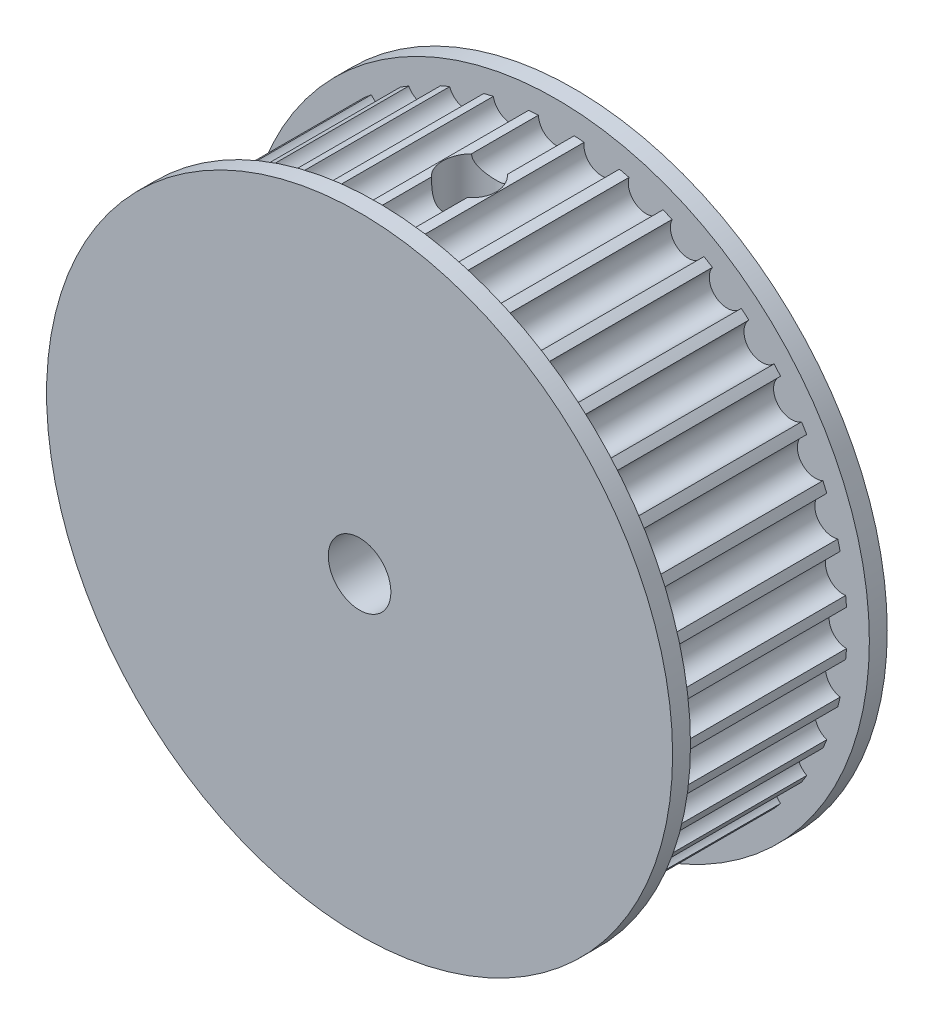
from build123d import *

# Parameters (mm, degrees)
SKETCH1_R           = 35
SKETCH1_R_2         = 3.5
BOSS_EXTRUDE1_DEPTH = 24
SKETCH3_OUTSIDE_W   = 92.372
SKETCH3_OUTSIDE_H   = 92.372
SKETCH3_OUTSIDE_R   = 32.5
CUT_EXTRUDE1_DEPTH  = 20
CUT_EXTRUDE2_DEPTH  = 20
SKETCH5_R           = 3
CUT_EXTRUDE3_DEPTH  = 56.009090158


with BuildPart() as part:
    # Sketch1 → Boss-Extrude1 (new body)
    with BuildSketch(Plane.XY):
        Circle(SKETCH1_R)
        Circle(SKETCH1_R_2, mode=Mode.SUBTRACT)
    extrude(amount=-BOSS_EXTRUDE1_DEPTH)

    # Sketch3 outside → Cut-Extrude1 (cut)
    with BuildSketch(Plane.XY.offset(-2)):
        Rectangle(SKETCH3_OUTSIDE_W, SKETCH3_OUTSIDE_H)
        Circle(SKETCH3_OUTSIDE_R, mode=Mode.SUBTRACT)
    extrude(amount=-CUT_EXTRUDE1_DEPTH, mode=Mode.SUBTRACT)

    # Sketch4 → Cut-Extrude2 (cut)
    with BuildSketch(Plane.XY.offset(-2)):
        with BuildLine():
            ThreePointArc((-20.684282661, 25.06811622), (-17.923091739, 24.669019428), (-17.449400423, 27.418395738))
            ThreePointArc((-17.449400423, 27.418395738), (-19.1030207, 26.293052317), (-20.684282661, 25.06811622))
        make_face()
        with BuildLine():
            ThreePointArc((-16.508107467, 27.995220804), (-13.84334388, 27.169092131), (-12.945387279, 29.810517409))
            ThreePointArc((-12.945387279, 29.810517409), (-14.754691242, 28.957712036), (-16.508107467, 27.995220804))
        make_face()
        with BuildLine():
            ThreePointArc((-11.925447881, 30.232990141), (-9.422726952, 29.000171617), (-8.122615736, 31.468605206))
            ThreePointArc((-8.122615736, 31.468605206), (-10.043052317, 30.90933678), (-11.925447881, 30.232990141))
        make_face()
        with BuildLine():
            ThreePointArc((-7.049144189, 31.726322923), (-4.770091215, 30.117170631), (-3.099838437, 32.351831504))
            ThreePointArc((-3.099838437, 32.351831504), (-5.084120114, 32.099871069), (-7.049144189, 31.726322923))
        make_face()
        with BuildLine():
            ThreePointArc((-1.999267173, 32.438448341), (-1.394942074, 31.059359006), (0, 30.492584951))
            Line((0, 30.492584951), (0, 32.5))
            ThreePointArc((0, 32.5), (-1.000107224, 32.484608441), (-1.999267173, 32.438448341))
        make_face()
        with BuildLine():
            Line((0, 32.5), (0, 30.492584951))
            ThreePointArc((0, 30.492584951), (1.394942074, 31.059359006), (1.999267173, 32.438448341))
            ThreePointArc((1.999267173, 32.438448341), (1.000107224, 32.484608441), (0, 32.5))
        make_face()
        with BuildLine():
            ThreePointArc((7.049144189, 31.726322923), (5.084120114, 32.099871069), (3.099838437, 32.351831504))
            ThreePointArc((3.099838437, 32.351831504), (4.770091215, 30.117170631), (7.049144189, 31.726322923))
        make_face()
        with BuildLine():
            ThreePointArc((11.925447881, 30.232990141), (10.043052317, 30.90933678), (8.122615736, 31.468605206))
            ThreePointArc((8.122615736, 31.468605206), (9.422726952, 29.000171617), (11.925447881, 30.232990141))
        make_face()
        with BuildLine():
            ThreePointArc((16.508107467, 27.995220804), (14.754691242, 28.957712036), (12.945387279, 29.810517409))
            ThreePointArc((12.945387279, 29.810517409), (13.84334388, 27.169092131), (16.508107467, 27.995220804))
        make_face()
        with BuildLine():
            ThreePointArc((20.684282661, 25.06811622), (19.1030207, 26.293052317), (17.449400423, 27.418395738))
            ThreePointArc((17.449400423, 27.418395738), (17.923091739, 24.669019428), (20.684282661, 25.06811622))
        make_face()
        with BuildLine():
            ThreePointArc((24.351142168, 21.523751418), (22.980970389, 22.980970389), (21.523751418, 24.351142168))
            ThreePointArc((21.523751418, 24.351142168), (21.561513595, 21.561513595), (24.351142168, 21.523751418))
        make_face()
        with BuildLine():
            ThreePointArc((27.418395738, 17.449400423), (26.293052317, 19.1030207), (25.06811622, 20.684282661))
            ThreePointArc((25.06811622, 20.684282661), (24.669019428, 17.923091739), (27.418395738, 17.449400423))
        make_face()
        with BuildLine():
            ThreePointArc((29.810517409, 12.945387279), (28.957712036, 14.754691242), (27.995220804, 16.508107467))
            ThreePointArc((27.995220804, 16.508107468), (27.169092131, 13.84334388), (29.810517409, 12.945387279))
        make_face()
        with BuildLine():
            ThreePointArc((31.468605206, 8.122615736), (30.90933678, 10.043052317), (30.232990141, 11.925447881))
            ThreePointArc((30.232990141, 11.925447881), (29.000171617, 9.422726952), (31.468605206, 8.122615736))
        make_face()
        with BuildLine():
            ThreePointArc((32.351831504, 3.099838437), (32.099871069, 5.084120114), (31.726322923, 7.049144189))
            ThreePointArc((31.726322923, 7.049144189), (30.117170631, 4.770091215), (32.351831504, 3.099838437))
        make_face()
        with BuildLine():
            ThreePointArc((32.5, 0), (32.484608441, 1.000107224), (32.438448341, 1.999267173))
            ThreePointArc((32.438448341, 1.999267173), (30.492584951, 0), (32.438448341, -1.999267173))
            ThreePointArc((32.438448341, -1.999267173), (32.484608441, -1.000107224), (32.5, 0))
        make_face()
        with BuildLine():
            ThreePointArc((31.726322923, -7.049144189), (32.099871069, -5.084120114), (32.351831504, -3.099838437))
            ThreePointArc((32.351831504, -3.099838437), (30.117170631, -4.770091215), (31.726322923, -7.049144189))
        make_face()
        with BuildLine():
            ThreePointArc((30.232990141, -11.925447881), (30.90933678, -10.043052317), (31.468605206, -8.122615736))
            ThreePointArc((31.468605206, -8.122615736), (29.000171617, -9.422726952), (30.232990141, -11.925447881))
        make_face()
        with BuildLine():
            ThreePointArc((27.995220804, -16.508107467), (28.957712036, -14.754691242), (29.810517409, -12.945387279))
            ThreePointArc((29.810517409, -12.945387279), (27.169092131, -13.84334388), (27.995220804, -16.508107467))
        make_face()
        with BuildLine():
            ThreePointArc((25.06811622, -20.684282661), (26.293052317, -19.103020699), (27.418395738, -17.449400423))
            ThreePointArc((27.418395739, -17.449400423), (24.669019428, -17.923091739), (25.06811622, -20.684282661))
        make_face()
        with BuildLine():
            ThreePointArc((21.523751418, -24.351142168), (22.980970389, -22.980970389), (24.351142168, -21.523751418))
            ThreePointArc((24.351142168, -21.523751418), (21.561513595, -21.561513595), (21.523751418, -24.351142168))
        make_face()
        with BuildLine():
            ThreePointArc((17.449400423, -27.418395738), (19.1030207, -26.293052317), (20.684282661, -25.06811622))
            ThreePointArc((20.684282661, -25.06811622), (17.923091739, -24.669019428), (17.449400423, -27.418395738))
        make_face()
        with BuildLine():
            ThreePointArc((12.945387279, -29.810517409), (14.754691242, -28.957712036), (16.508107468, -27.995220804))
            ThreePointArc((16.508107468, -27.995220804), (13.843343881, -27.169092131), (12.945387279, -29.810517409))
        make_face()
        with BuildLine():
            ThreePointArc((8.122615736, -31.468605206), (10.043052317, -30.90933678), (11.925447881, -30.232990141))
            ThreePointArc((11.925447881, -30.232990141), (9.422726952, -29.000171617), (8.122615736, -31.468605206))
        make_face()
        with BuildLine():
            ThreePointArc((3.099838437, -32.351831504), (5.084120114, -32.099871069), (7.049144189, -31.726322923))
            ThreePointArc((7.049144189, -31.726322923), (4.770091215, -30.117170631), (3.099838437, -32.351831504))
        make_face()
        with BuildLine():
            ThreePointArc((1.999267173, -32.438448341), (0, -30.492584951), (-1.999267173, -32.438448341))
            ThreePointArc((-1.999267173, -32.438448341), (0, -32.5), (1.999267173, -32.438448341))
        make_face()
        with BuildLine():
            ThreePointArc((-3.099838437, -32.351831504), (-4.770091215, -30.117170631), (-7.049144189, -31.726322923))
            ThreePointArc((-7.049144189, -31.726322923), (-5.084120114, -32.099871069), (-3.099838437, -32.351831504))
        make_face()
        with BuildLine():
            ThreePointArc((-8.122615736, -31.468605206), (-9.422726952, -29.000171617), (-11.925447881, -30.232990141))
            ThreePointArc((-11.925447881, -30.232990141), (-10.043052317, -30.90933678), (-8.122615736, -31.468605206))
        make_face()
        with BuildLine():
            ThreePointArc((-12.945387279, -29.810517409), (-13.84334388, -27.169092131), (-16.508107467, -27.995220804))
            ThreePointArc((-16.508107467, -27.995220804), (-14.754691242, -28.957712036), (-12.945387279, -29.810517409))
        make_face()
        with BuildLine():
            ThreePointArc((-17.449400423, -27.418395738), (-17.923091739, -24.669019428), (-20.684282661, -25.06811622))
            ThreePointArc((-20.684282661, -25.06811622), (-19.103020699, -26.293052317), (-17.449400423, -27.418395738))
        make_face()
        with BuildLine():
            ThreePointArc((-21.523751418, -24.351142168), (-21.561513595, -21.561513595), (-24.351142168, -21.523751418))
            ThreePointArc((-24.351142168, -21.523751418), (-22.980970389, -22.980970389), (-21.523751418, -24.351142168))
        make_face()
        with BuildLine():
            ThreePointArc((-25.06811622, -20.684282661), (-24.669019428, -17.923091739), (-27.418395738, -17.449400423))
            ThreePointArc((-27.418395738, -17.449400423), (-26.293052317, -19.1030207), (-25.06811622, -20.684282661))
        make_face()
        with BuildLine():
            ThreePointArc((-27.995220804, -16.508107468), (-27.169092131, -13.84334388), (-29.810517409, -12.945387279))
            ThreePointArc((-29.810517409, -12.945387279), (-28.957712036, -14.754691242), (-27.995220804, -16.508107468))
        make_face()
        with BuildLine():
            ThreePointArc((-30.232990141, -11.925447881), (-29.000171617, -9.422726952), (-31.468605206, -8.122615736))
            ThreePointArc((-31.468605206, -8.122615736), (-30.90933678, -10.043052317), (-30.232990141, -11.925447881))
        make_face()
        with BuildLine():
            ThreePointArc((-31.726322923, -7.049144189), (-30.117170631, -4.770091215), (-32.351831504, -3.099838437))
            ThreePointArc((-32.351831504, -3.099838437), (-32.099871069, -5.084120114), (-31.726322923, -7.049144189))
        make_face()
        with BuildLine():
            ThreePointArc((-32.438448341, -1.999267173), (-30.492584951, 0), (-32.438448341, 1.999267173))
            ThreePointArc((-32.438448341, 1.999267173), (-32.5, 0), (-32.438448341, -1.999267173))
        make_face()
        with BuildLine():
            ThreePointArc((-32.351831504, 3.099838437), (-30.117170631, 4.770091215), (-31.726322923, 7.049144189))
            ThreePointArc((-31.726322923, 7.049144189), (-32.099871069, 5.084120114), (-32.351831504, 3.099838437))
        make_face()
        with BuildLine():
            ThreePointArc((-31.468605206, 8.122615736), (-29.000171617, 9.422726952), (-30.232990141, 11.925447881))
            ThreePointArc((-30.232990141, 11.925447881), (-30.90933678, 10.043052317), (-31.468605206, 8.122615736))
        make_face()
        with BuildLine():
            ThreePointArc((-29.810517409, 12.945387279), (-27.169092131, 13.84334388), (-27.995220804, 16.508107467))
            ThreePointArc((-27.995220804, 16.508107467), (-28.957712036, 14.754691242), (-29.810517409, 12.945387279))
        make_face()
        with BuildLine():
            ThreePointArc((-27.418395738, 17.449400423), (-24.669019428, 17.923091739), (-25.06811622, 20.684282661))
            ThreePointArc((-25.06811622, 20.684282661), (-26.293052317, 19.103020699), (-27.418395738, 17.449400423))
        make_face()
        with BuildLine():
            ThreePointArc((-24.351142168, 21.523751418), (-21.561513595, 21.561513595), (-21.523751418, 24.351142168))
            ThreePointArc((-21.523751418, 24.351142168), (-22.980970389, 22.980970389), (-24.351142168, 21.523751418))
        make_face()
    extrude(amount=-CUT_EXTRUDE2_DEPTH, mode=Mode.SUBTRACT)

    # Sketch5 → Cut-Extrude3 (cut, through all)
    with BuildSketch(Plane(origin=(0, 0, 0), x_dir=(1, 0, 0), z_dir=(0, 1, 0))):
        with Locations(Location((0, 12.279237026, 0), (0, 0, 90))):
            Circle(SKETCH5_R)
    extrude(amount=CUT_EXTRUDE3_DEPTH, mode=Mode.SUBTRACT)


solid = part.part
